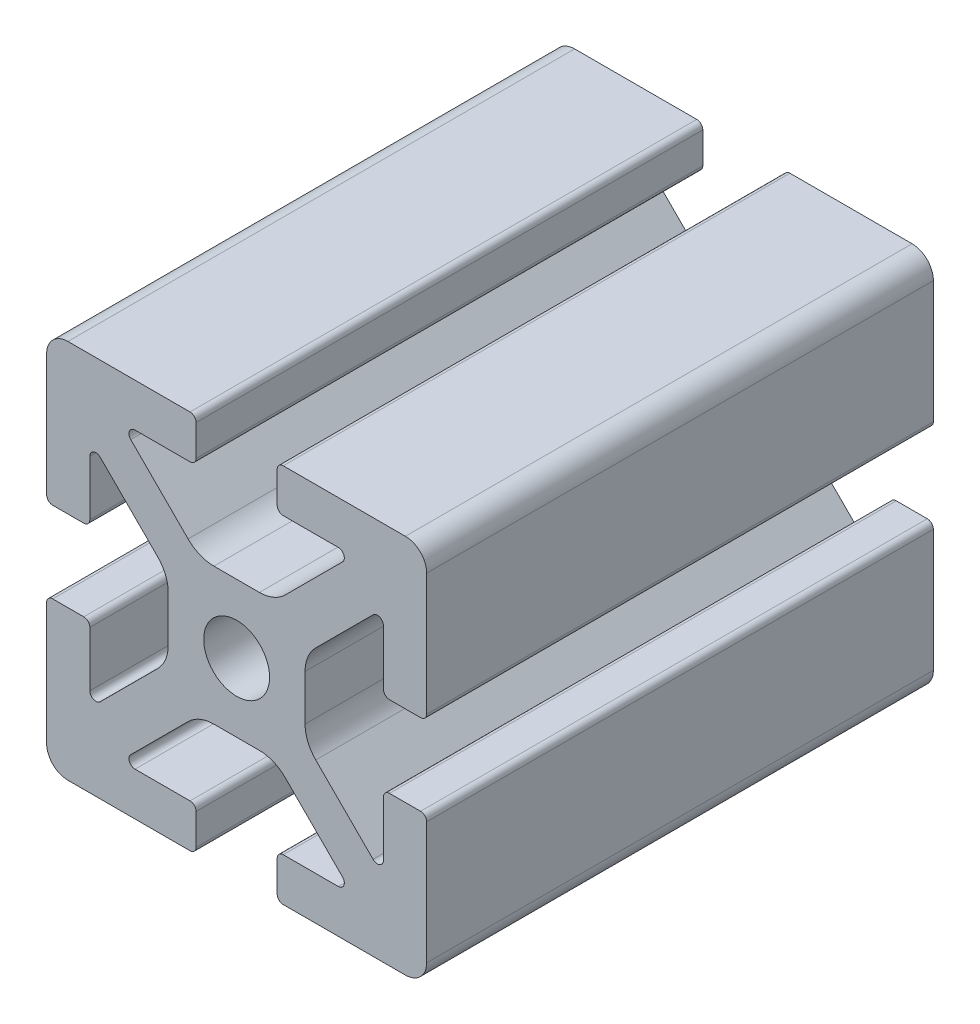
from build123d import *

# Parameters (mm, degrees)
BOSS_EXTRUDE1_DEPTH = 25.4


with BuildPart() as part:
    # Sketch4 → Boss-Extrude1 (new, symmetric)
    with BuildSketch(Plane.XY):
        with BuildLine():
            Line((4.6736, -19.05), (16.9164, -19.05))
            ThreePointArc((16.9164, -19.05), (18.425083028, -18.425083028), (19.05, -16.9164))
            Line((19.05, -16.9164), (19.05, -4.6736))
            ThreePointArc((19.05, -4.6736), (18.871452294, -4.242547706), (18.4404, -4.064))
            Line((18.4404, -4.064), (15.328942133, -4.064))
            ThreePointArc((15.328942133, -4.064), (14.897889839, -4.242547706), (14.719342133, -4.6736))
            Line((14.719342133, -4.6736), (14.719342133, -10.1854))
            ThreePointArc((14.719342133, -10.1854), (14.343025953, -10.748596963), (13.678689839, -10.616452294))
            Line((13.678689839, -10.616452294), (7.929286237, -4.867048692))
            ThreePointArc((7.929286237, -4.867048692), (7.136418222, -3.680437851), (6.858, -2.280734929))
            Line((6.858, -2.280734929), (6.858, 0))
            Line((6.858, 0), (3.302, 0))
            ThreePointArc((3.302, 0), (2.334866591, -2.334866591), (0, -3.302))
            Line((0, -3.302), (0, -6.858))
            Line((0, -6.858), (2.280734929, -6.858))
            ThreePointArc((2.280734929, -6.858), (3.680437851, -7.136418222), (4.867048692, -7.929286237))
            Line((4.867048692, -7.929286237), (10.616452294, -13.678689839))
            ThreePointArc((10.616452294, -13.678689839), (10.748596963, -14.343025953), (10.1854, -14.719342133))
            Line((10.1854, -14.719342133), (4.6736, -14.719342133))
            ThreePointArc((4.6736, -14.719342133), (4.242547706, -14.897889839), (4.064, -15.328942133))
            Line((4.064, -15.328942133), (4.064, -18.4404))
            ThreePointArc((4.064, -18.4404), (4.242547706, -18.871452294), (4.6736, -19.05))
        make_face()
    extrude(amount=BOSS_EXTRUDE1_DEPTH, both=True)

    # Mirror1: part across plane


with BuildPart() as part_1:
    add(part.part)
    add(part.part.mirror(Plane(origin=(0, 0, 0), x_dir=(0, 0, 1), z_dir=(1, 0, 0))))

    # Mirror2: part across plane


with BuildPart() as part_2:
    add(part_1.part)
    add(part_1.part.mirror(Plane.ZX))


solid = part_2.part
